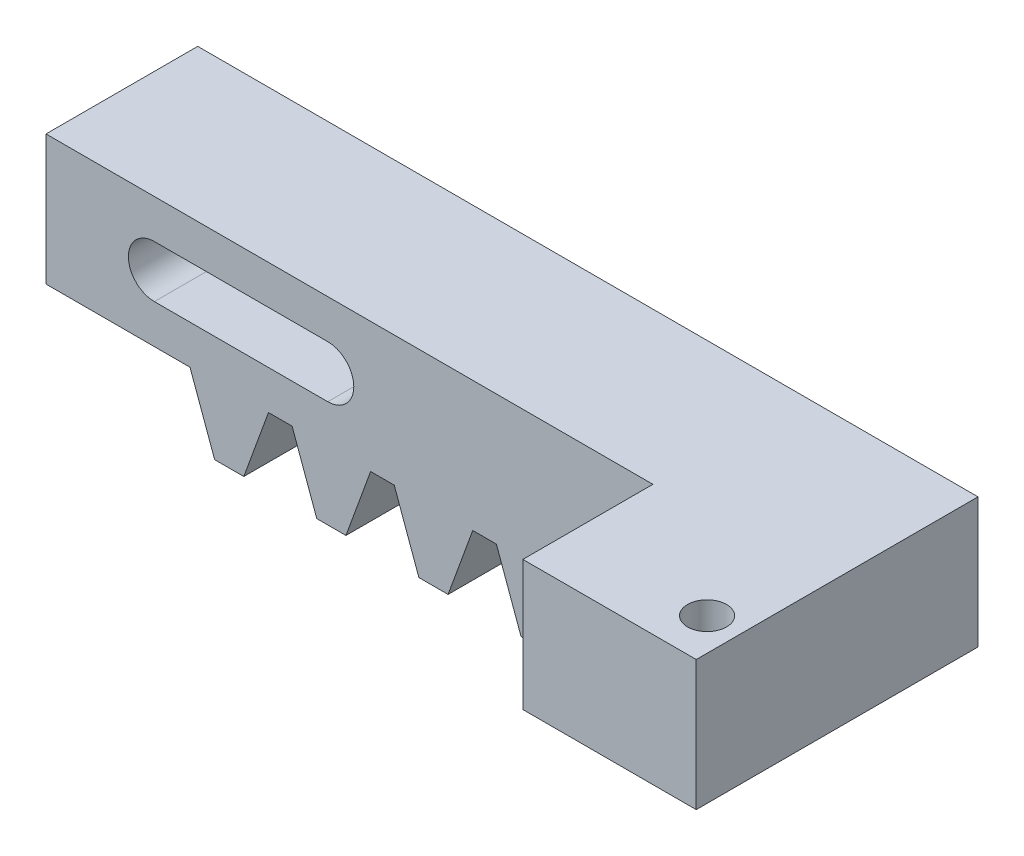
from build123d import *

# Parameters (mm, degrees)
BOSS_EXTRUDE1_START     = 13.5
BOSS_EXTRUDE1_DEPTH     = 7
BOSS_EXTRUDE2_START     = 20.5
SKETCH2_W               = 8
SKETCH2_H               = 6
BOSS_EXTRUDE2_DEPTH     = 6
CUT_EXTRUDE1_DEPTH      = 39.389329572
CUT_EXTRUDE1_DEPTH_BACK = 39.389329572
SKETCH3_R               = 0.9
CUT_EXTRUDE2_DEPTH      = 39.389329572
CUT_EXTRUDE2_DEPTH_BACK = 39.389329572
SKETCH4_W               = 8
SKETCH4_H               = 2.4
CUT_EXTRUDE3_DEPTH      = 39.389329572
CUT_EXTRUDE3_DEPTH_BACK = 39.389329572
SKETCH5_R               = 1.2


with BuildPart() as part:
    # Sketch1 → Boss-Extrude1 (new body)
    with BuildSketch(Plane.XY.offset(BOSS_EXTRUDE1_START)):
        Polygon((-16.7, 19.975), (19.3, 19.975), (19.3, 13.975), (17.125805621, 13.975), (15.988398639, 10.85), (14.642129734, 10.85), (13.504722752, 13.975), (12.41341664, 13.975), (11.276009658, 10.85), (9.929740754, 10.85), (8.792333772, 13.975), (7.70102766, 13.975), (6.563620678, 10.85), (5.217351773, 10.85), (4.079944791, 13.975), (2.988638679, 13.975), (1.851231697, 10.85), (0.504962793, 10.85), (-0.632444189, 13.975), (-1.723750301, 13.975), (-2.861157283, 10.85), (-4.207426188, 10.85), (-5.34483317, 13.975), (-6.436139281, 13.975), (-7.573546263, 10.85), (-8.919815168, 10.85), (-10.05722215, 13.975), (-16.7, 13.975), align=None)
    extrude(amount=BOSS_EXTRUDE1_DEPTH)

    # Sketch2 → Boss-Extrude2 (add)
    with BuildSketch(Plane.XY.offset(BOSS_EXTRUDE2_START)):
        with Locations((15.3, 16.975)):
            Rectangle(SKETCH2_W, SKETCH2_H)
    extrude(amount=BOSS_EXTRUDE2_DEPTH)

    # Sketch3 → Cut-Extrude1 (cut, two sides: drawn at the far end of the back side and taken through both)
    with BuildSketch(Plane(origin=(0, 0, 0), x_dir=(1, 0, 0), z_dir=(0, 1, 0)).offset(-CUT_EXTRUDE1_DEPTH_BACK)):
        with Locations(Location((17.8, -24.5, 0), (0, 0, 270))):
            Circle(SKETCH3_R)
    extrude(amount=CUT_EXTRUDE1_DEPTH + CUT_EXTRUDE1_DEPTH_BACK, mode=Mode.SUBTRACT)

    # Sketch4 → Cut-Extrude2 (cut, two sides: drawn at the far end of the back side and taken through both)
    with BuildSketch(Plane.XY.offset(-CUT_EXTRUDE2_DEPTH_BACK)):
        with Locations((-7.7, 16.975)):
            Rectangle(SKETCH4_W, SKETCH4_H)
    extrude(amount=CUT_EXTRUDE2_DEPTH + CUT_EXTRUDE2_DEPTH_BACK, mode=Mode.SUBTRACT)

    # Sketch5 → Cut-Extrude3 (cut, two sides: drawn at the far end of the back side and taken through both)
    with BuildSketch(Plane.XY.offset(-CUT_EXTRUDE3_DEPTH_BACK)):
        with Locations((-11.7, 16.975)):
            Circle(SKETCH5_R)
        with Locations((-3.7, 16.975)):
            Circle(SKETCH5_R)
    extrude(amount=CUT_EXTRUDE3_DEPTH + CUT_EXTRUDE3_DEPTH_BACK, mode=Mode.SUBTRACT)


solid = part.part
